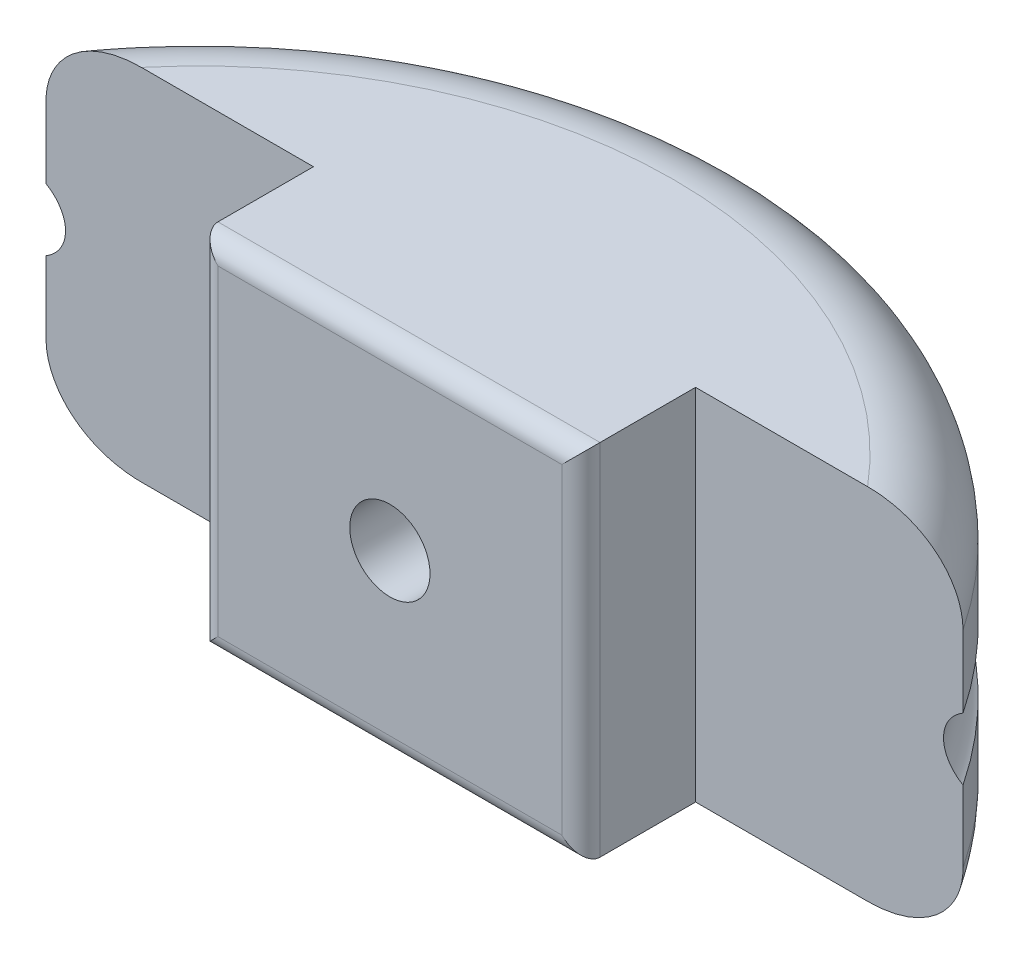
from build123d import *

# Parameters (mm, degrees)
BOSS_EXTRU_2_DEPTH      = 9.4
ESQUISSE13_R            = 1
ESQUISSE14_R            = 1.05
ENL_V_MAT_EXTRU_1_DEPTH = 22.590228256
ESQUISSE15_R            = 2.5
ENL_V_MAT_EXTRU_2_DEPTH = 8.4
CONG_2_R                = 0.5
CONG_3_R                = 2


with BuildPart() as part:
    # Esquisse1 → Boss.-Extru.2 (new body)
    with BuildSketch(Plane(origin=(0, 0, 0), x_dir=(1, 0, 0), z_dir=(0, 1, 0))):
        with BuildLine():
            ThreePointArc((-7, 3), (5, 9.422205102), (17, 3))
            Line((17, 3), (10, 3))
            Line((10, 3), (10, 0))
            Line((10, 0), (0, 0))
            Line((0, 0), (0, 3))
            Line((0, 3), (-7, 3))
        make_face()
    extrude(amount=BOSS_EXTRU_2_DEPTH)

    # Esquisse13 → Enlèvement de matière-Révolution4 (revolve, cut)
    with BuildSketch(Plane.XY.offset(5)):
        with Locations((-10, 4.7)):
            Circle(ESQUISSE13_R)
    revolve(axis=Axis((5, 9.4, 5), (0, -1, 0)), mode=Mode.SUBTRACT)

    # Esquisse14 → Enlèv. mat.-Extru.1 (cut, through all)
    with BuildSketch(Plane.XY):
        with Locations((5, 4.7)):
            Circle(ESQUISSE14_R)
    extrude(amount=-ENL_V_MAT_EXTRU_1_DEPTH, mode=Mode.SUBTRACT)

    # Esquisse15 → Enlèv. mat.-Extru.2 (cut)
    with BuildSketch(Plane.XY.offset(-10)):
        with Locations(Location((5, 4.7, 0), (0, 0, 199.054827186))):
            Circle(ESQUISSE15_R)
    extrude(amount=ENL_V_MAT_EXTRU_2_DEPTH, mode=Mode.SUBTRACT)

    # Congé2
    cong_2_edges = [part.edges().sort_by_distance(p)[0] for p in [
        (10, 4.7, 0),
        (0, 4.7, 0),
        (5, 9.4, 0),
        (5, 0, 0),
    ]]
    fillet(cong_2_edges, radius=CONG_2_R)

    # Congé3
    cong_3_edges = [part.edges().sort_by_distance(p)[0] for p in [
        (5, 0, -9.422205102),
        (5, 9.4, -9.422205102),
    ]]
    fillet(cong_3_edges, radius=CONG_3_R)


solid = part.part
